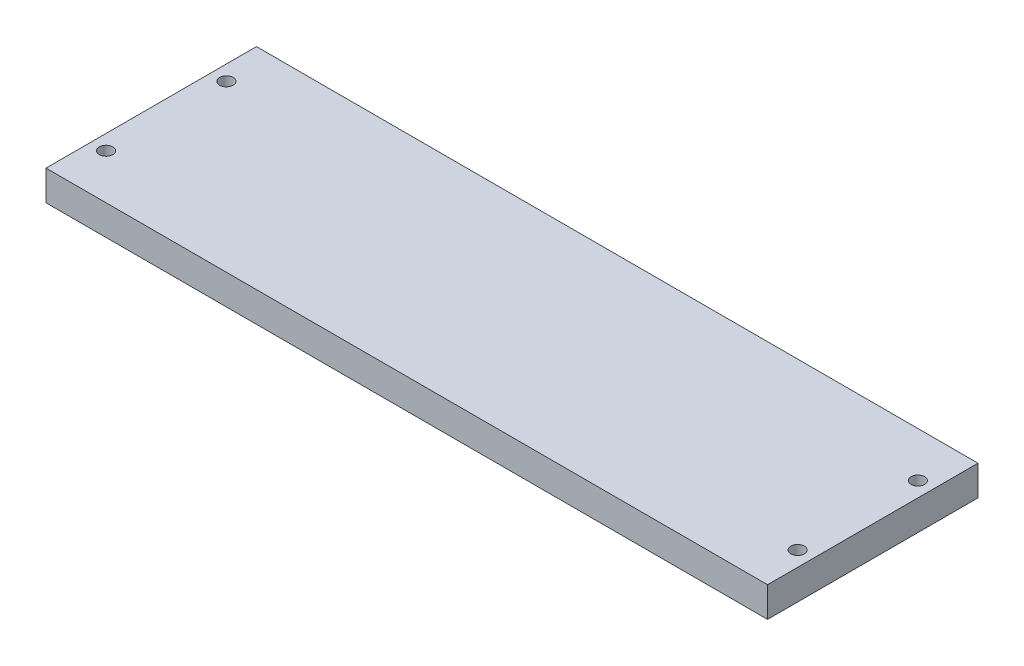
from build123d import *

# Parameters (mm, degrees)
CROQUIS1_W              = 240
CROQUIS1_H              = 70
SALIENTE_EXTRUIR1_DEPTH = 5
CROQUIS2_R              = 2.25
CORTAR_EXTRUIR1_DEPTH   = 126.39936204


with BuildPart() as part:
    # Croquis1 → Saliente-Extruir1 (new, symmetric)
    with BuildSketch(Plane(origin=(0, 0, 0), x_dir=(1, 0, 0), z_dir=(0, 1, 0))):
        Rectangle(CROQUIS1_W, CROQUIS1_H)
    extrude(amount=SALIENTE_EXTRUIR1_DEPTH, both=True)

    # Croquis2 → Cortar-Extruir1 (cut, through all)
    with BuildSketch(Plane(origin=(0, 5, 0), x_dir=(1, 0, 0), z_dir=(0, 1, 0))):
        with Locations(Location((-115, 20, 0), (0, 0, 270))):
            Circle(CROQUIS2_R)
        with Locations(Location((-115, -20, 0), (0, 0, 270))):
            Circle(CROQUIS2_R)
        with Locations(Location((115, -20, 0), (0, 0, 90))):
            Circle(CROQUIS2_R)
        with Locations(Location((115, 20, 0), (0, 0, 90))):
            Circle(CROQUIS2_R)
    extrude(amount=-CORTAR_EXTRUIR1_DEPTH, mode=Mode.SUBTRACT)


solid = part.part
